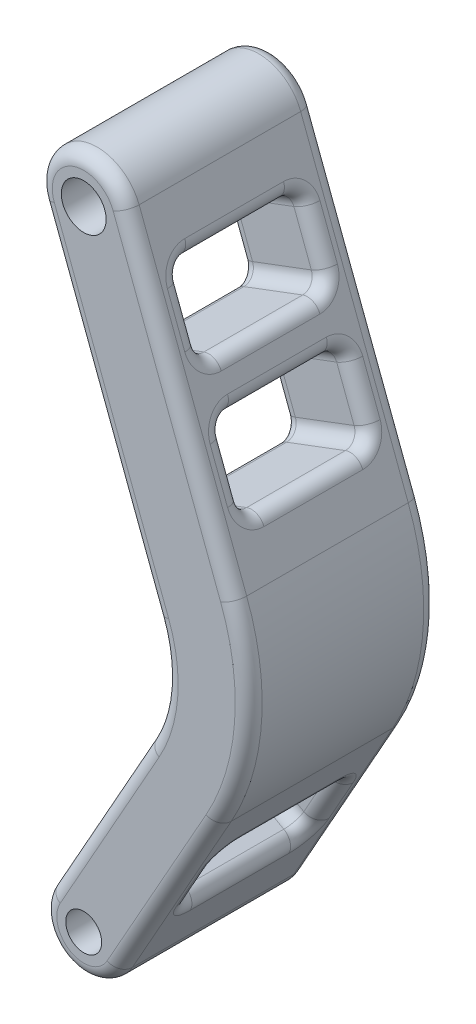
from build123d import *

# Parameters (mm, degrees)
SKETCH1_R           = 4
SKETCH1_R_2         = 5
BOSS_EXTRUDE1_DEPTH = 42
SKETCH2_W           = 28
SKETCH2_H           = 17
CUT_EXTRUDE1_DEPTH  = 42
SKETCH3_W           = 28
SKETCH3_H           = 17
CUT_EXTRUDE2_DEPTH  = 42
FILLET1_R           = 3


with BuildPart() as part:
    # Sketch1 → Boss-Extrude1 (new body)
    with BuildSketch(Plane.XY):
        with BuildLine():
            Line((-7.84582424, 4.409426492), (14.20130822, 43.638547694))
            ThreePointArc((14.20130822, 43.638547694), (17.962679965, 56.068272789), (16.118611655, 68.923053821))
            Line((16.118611655, 68.923053821), (-9.356683635, 136.47119406))
            ThreePointArc((-9.356683635, 136.47119406), (-3.52880594, 149.356683635), (9.356683635, 143.52880594))
            Line((9.356683635, 143.52880594), (33.318469172, 79.993760263))
            ThreePointArc((33.318469172, 79.993760263), (36.613137548, 57.027018571), (29.892956701, 34.81969471))
            Line((29.892956701, 34.81969471), (7.84582424, -4.409426492))
            ThreePointArc((7.84582424, -4.409426492), (-4.409426492, -7.84582424), (-7.84582424, 4.409426492))
        make_face()
        with Locations(Location((0, 0, 0), (0, 0, 180))):
            Circle(SKETCH1_R, mode=Mode.SUBTRACT)
        with Locations(Location((0, 140, 0), (0, 0, 180))):
            Circle(SKETCH1_R_2, mode=Mode.SUBTRACT)
    extrude(amount=BOSS_EXTRUDE1_DEPTH)

    # Sketch2 → Cut-Extrude1 (cut)
    with BuildSketch(Plane(origin=(36.868405471, 13.904653969, 0), x_dir=(0, 0, 1), z_dir=(-0.9356683634521398, -0.3528805940184224, 0))):
        with Locations((21, 110.493570883)):
            Rectangle(SKETCH2_W, SKETCH2_H)
        with Locations((21, 83.493570883)):
            Rectangle(SKETCH2_W, SKETCH2_H)
    extrude(amount=-CUT_EXTRUDE1_DEPTH, mode=Mode.SUBTRACT)

    # Sketch3 → Cut-Extrude2 (cut)
    with BuildSketch(Plane(origin=(-7.84582424, 4.409426492, 0), x_dir=(0, 0, 1), z_dir=(-0.8717582489350522, 0.48993627689087443, 0))):
        with Locations((21, 23.5)):
            Rectangle(SKETCH3_W, SKETCH3_H)
    extrude(amount=-CUT_EXTRUDE2_DEPTH, mode=Mode.SUBTRACT)

    # Fillet1
    fillet1_edges = [part.edges().sort_by_distance(p)[0] for p in [
        (-3.52880594, 149.356683635, 42),
        (21.337576403, 111.761283102, 0),
        (36.613137548, 57.027018571, 0),
        (3.38096401, 102.697123941, 42),
        (17.962679965, 56.068272789, 42),
        (3.17774199, 24.023987093, 42),
        (-4.409426492, -7.84582424, 42),
        (18.86939047, 15.205134109, 42),
        (16.590735812, 124.347604489, 7),
        (10.233537227, 112.86561746, 7),
        (13.591250763, 132.300785579, 21),
        (4.234567128, 128.771979639, 7),
        (16.590735812, 124.347604489, 35),
        (4.234567128, 128.771979639, 35),
        (19.590220861, 116.3944234, 21),
        (10.233537227, 112.86561746, 35),
        (-2.122631457, 117.289992609, 7),
        (0.876853592, 109.33681152, 21),
        (-2.122631457, 117.289992609, 35),
        (-5.122116506, 125.243173698, 21),
        (36.613137548, 57.027018571, 42),
        (23.119026801, 107.037739766, 21),
        (13.762343167, 103.508933825, 7),
        (26.11851185, 99.084558676, 35),
        (13.762343167, 103.508933825, 35),
        (29.1179969, 91.131377587, 21),
        (19.761313265, 87.602571647, 35),
        (26.11851185, 99.084558676, 7),
        (19.761313265, 87.602571647, 7),
        (4.405659532, 99.980127885, 21),
        (7.405144581, 92.026946796, 7),
        (10.404629631, 84.073765706, 21),
        (7.405144581, 92.026946796, 35),
        (15.194868394, 8.666947242, 21),
        (19.359326747, 16.076892358, 35),
        (23.523785101, 23.486837474, 21),
        (19.359326747, 16.076892358, 7),
        (21.337576403, 111.761283102, 42),
        (7.349044153, 13.076373734, 7),
        (15.677960861, 27.896263966, 7),
        (15.677960861, 27.896263966, 35),
        (7.349044153, 13.076373734, 35),
        (3.667678267, 24.895745342, 7),
        (-0.496780087, 17.485800226, 21),
        (3.667678267, 24.895745342, 35),
        (7.83213662, 32.305690458, 21),
        (18.86939047, 15.205134109, 0),
        (-4.409426492, -7.84582424, 0),
        (3.17774199, 24.023987093, 0),
        (17.962679965, 56.068272789, 0),
        (3.38096401, 102.697123941, 0),
        (-3.52880594, 149.356683635, 0),
    ]]
    fillet(fillet1_edges, radius=FILLET1_R)


solid = part.part
